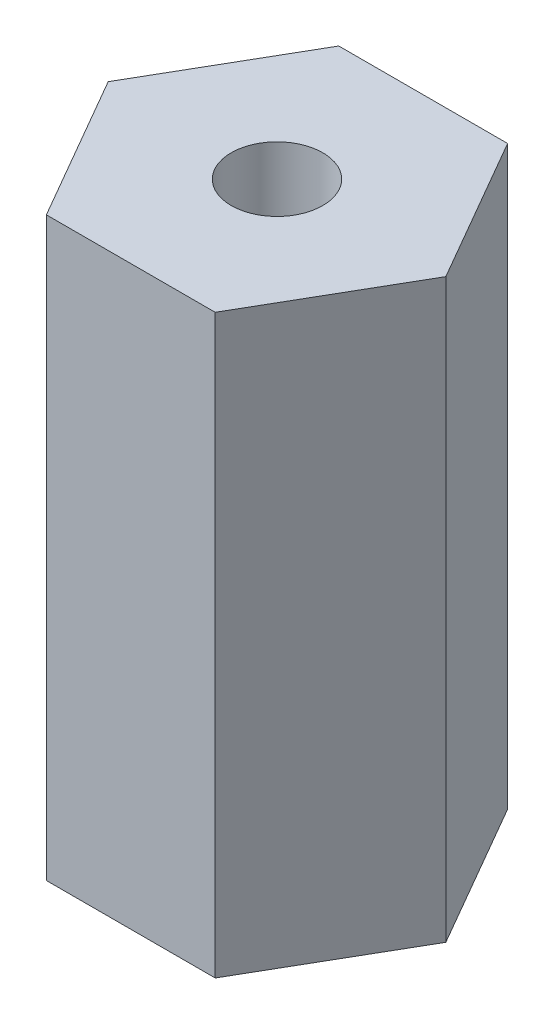
from build123d import *

# Parameters (mm, degrees)
BOSS_EXTRUDE1_DEPTH     = 12.5
CUT_EXTRUDE1_DEPTH      = 16.812644729
CUT_EXTRUDE1_DEPTH_BACK = 16.812644729
SKETCH3_R               = 1.985


with BuildPart() as part:
    # Sketch2 → Boss-Extrude1 (new, symmetric)
    with BuildSketch(Plane(origin=(0, 0, 0), x_dir=(1, 0, 0), z_dir=(0, 1, 0))):
        Polygon((7.320801413, 0), (3.660400707, 6.34), (-3.660400707, 6.34), (-7.320801413, 0), (-3.660400707, -6.34), (3.660400707, -6.34), align=None)
    extrude(amount=BOSS_EXTRUDE1_DEPTH, both=True)

    # Sketch3 → Cut-Extrude1 (cut, two sides: drawn at the far end of the back side and taken through both)
    with BuildSketch(Plane(origin=(0, 0, 0), x_dir=(1, 0, 0), z_dir=(0, 1, 0)).offset(-CUT_EXTRUDE1_DEPTH_BACK)):
        with Locations(Location((0, 0, 0), (0, 0, 270))):
            Circle(SKETCH3_R)
    extrude(amount=CUT_EXTRUDE1_DEPTH + CUT_EXTRUDE1_DEPTH_BACK, mode=Mode.SUBTRACT)


solid = part.part
